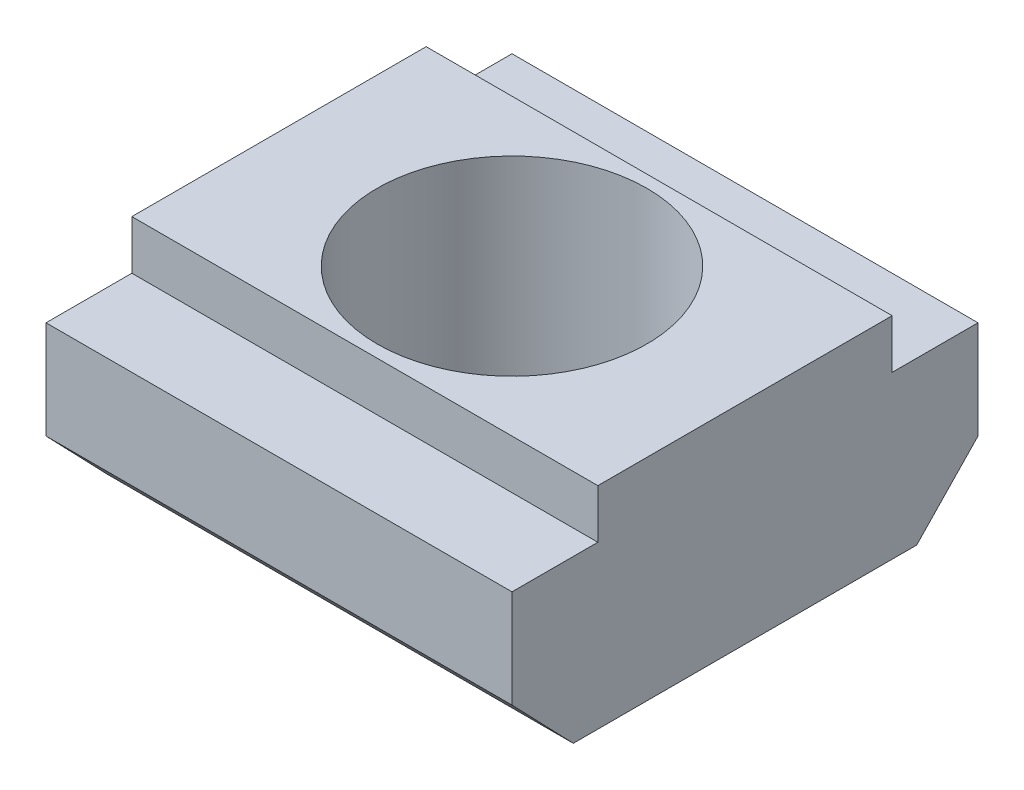
from build123d import *

# Parameters (mm, degrees)
BODY_DEPTH           = 4.75
M5_CLEARANCE_HOLE1_D = 5.5


with BuildPart() as part:
    # Sketch1 → Body (new, symmetric)
    with BuildSketch(Plane(origin=(0, 0, 0), x_dir=(0, 0, -1), z_dir=(1, 0, 0))):
        Polygon((-3.5, 0), (3.5, 0), (4.75, 1.3), (4.75, 3.3), (3, 3.3), (3, 4.3), (-3, 4.3), (-3, 3.3), (-4.75, 3.3), (-4.75, 1.3), align=None)
    extrude(amount=BODY_DEPTH, both=True)

    # M5 Clearance Hole1 (through all)
    with Locations(Plane(origin=(0, 4.3, 0), x_dir=(1, 0, 0), z_dir=(0, 1, 0))):
        with Locations((0, 0)):
            Hole(M5_CLEARANCE_HOLE1_D / 2)


solid = part.part
